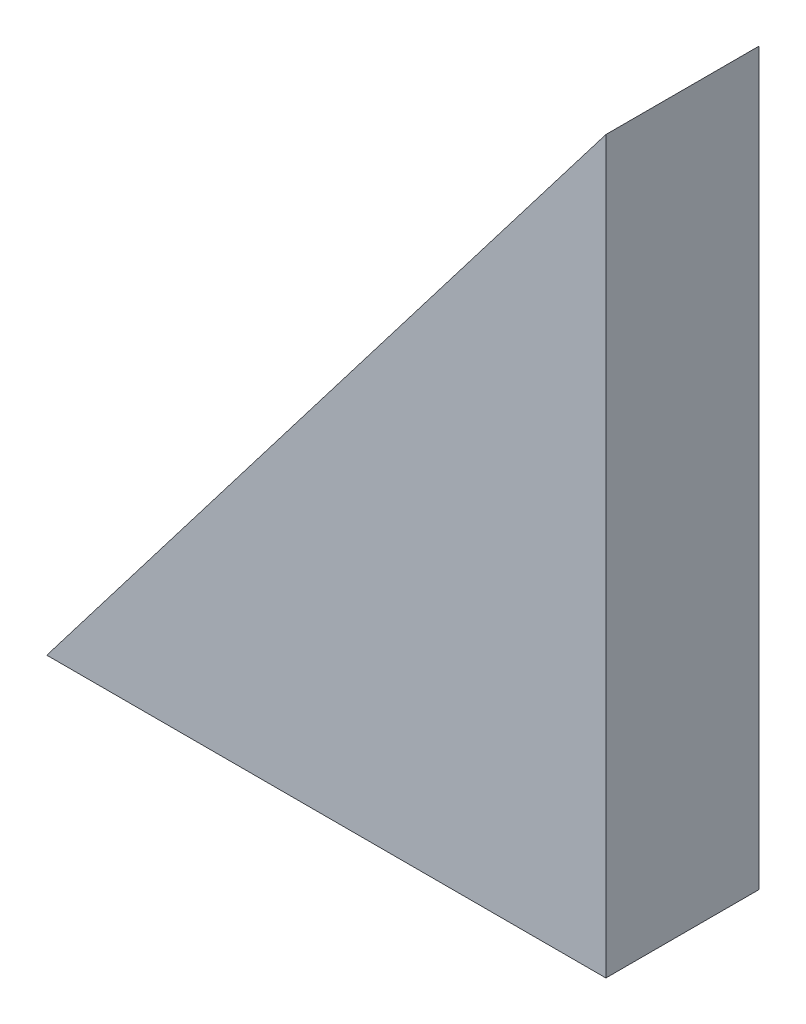
from build123d import *

# Parameters (mm, degrees)
EXTRUDE1_DEPTH = 12.7


with BuildPart() as part:
    # Sketch1 → Extrude1 (new body)
    with BuildSketch(Plane.XY):
        Polygon((-0.101081025, 121.020305138), (-0.101081025, 60.510152569), (-46.414809401, 60.510152569), align=None)
    extrude(amount=EXTRUDE1_DEPTH)


solid = part.part
